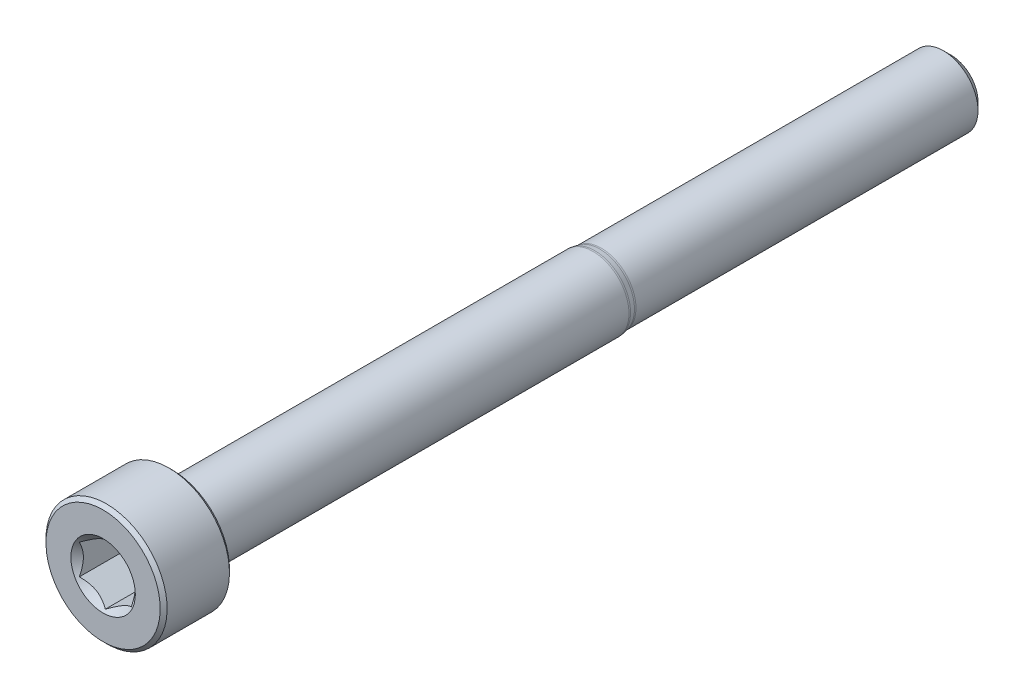
from build123d import *

# Parameters (mm, degrees)
CUT_EXTRUDE1_DEPTH = 3


with BuildPart() as part:
    # Sketch2 → Revolve1 (revolve)
    with BuildSketch(Plane(origin=(0, 0, 0), x_dir=(0, 0, -1), z_dir=(1, 0, 0))):
        with BuildLine():
            Line((-24.5, 0), (-24.5, 3.3))
            Line((-24.5, 3.3), (-24.3, 3.5))
            Line((-24.3, 3.5), (-20.7, 3.5))
            Line((-20.7, 3.5), (-20.5, 3.3))
            Line((-20.5, 3.3), (-20.5, 2.275777223))
            ThreePointArc((-20.5, 2.275777223), (-20.441421356, 2.134355867), (-20.3, 2.075777223))
            Line((-20.3, 2.075777223), (3.807296473, 2.075777223))
            ThreePointArc((3.807296473, 2.075777223), (3.856305044, 2.073369586), (3.904841634, 2.066169863))
            Line((3.904841634, 2.066169863), (4.189200541, 2.00960736))
            ThreePointArc((4.189200541, 2.00960736), (4.237737132, 2.002407637), (4.286745702, 2))
            Line((4.286745702, 2), (24.045336663, 2))
            Line((24.045336663, 2), (24.5, 1.545336663))
            Line((24.5, 1.545336663), (24.5, 0))
            Line((24.5, 0), (-24.5, 0))
        make_face()
    revolve(axis=Axis((0, 0, -24.5), (0, 0, 1)))

    # Sketch3 → Cut-Extrude1 (cut)
    with BuildSketch(Plane.XY.offset(24.5)):
        Polygon((1.5, -0.866025404), (1.5, 0.866025404), (0, 1.732050808), (-1.5, 0.866025404), (-1.5, -0.866025404), (0, -1.732050808), align=None)
    extrude(amount=-CUT_EXTRUDE1_DEPTH, mode=Mode.SUBTRACT)

    # Cut-Extrude2 cone 1 section (through the dimple's axis) → Cut-Extrude2 (revolve, cut)
    with BuildSketch(Plane(origin=(0, 0, 24.5), x_dir=(0, -1, 0), z_dir=(1, 0, 0))):
        Polygon((0, 0), (1.861954618, 0), (0, 1.861954618), align=None)
    revolve(axis=Axis((0, 0, 24.5), (0, 0, -1)), mode=Mode.SUBTRACT)


solid = part.part
